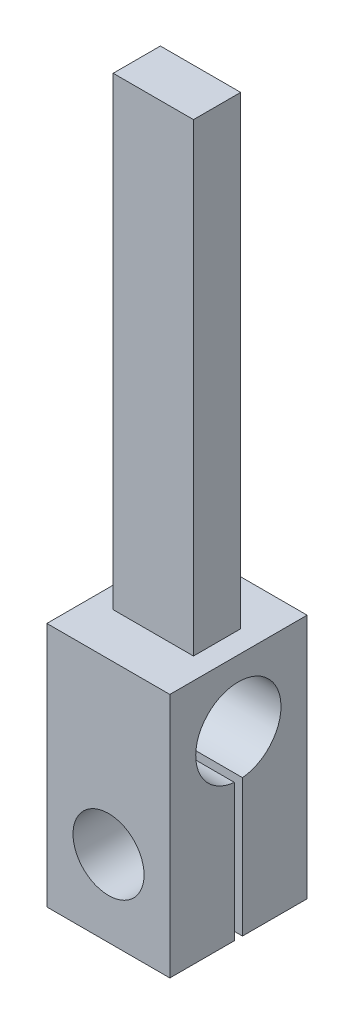
from build123d import *

# Parameters (mm, degrees)
BOSS_EXTRUDE2_DEPTH = 4.5
SKETCH3_R           = 1.3
CUT_EXTRUDE1_DEPTH  = 10.5
SKETCH6_W           = 2.938556516
SKETCH6_H           = 1.727001967
BOSS_EXTRUDE5_DEPTH = 17


with BuildPart() as part:
    # Sketch1 → Boss-Extrude2 (new body)
    with BuildSketch(Plane(origin=(0, 0, 0), x_dir=(0, 0, -1), z_dir=(1, 0, 0))):
        with BuildLine():
            Line((1.55613054, -9.91539795), (3.9164982, -9.916319844))
            Line((3.9164982, -9.916319844), (3.9164982, -4.895563354))
            ThreePointArc((3.9164982, -4.895563354), (4.059992057, -1.782444065), (4.214804462, -4.895021022))
            Line((4.214804462, -4.895021022), (4.214804462, -9.916436354))
            Line((4.214804462, -9.916436354), (6.579674081, -9.917360006))
            Line((6.579674081, -9.917360006), (6.579674081, -0.928463249))
            Line((6.579674081, -0.928463249), (1.55613054, -0.928463249))
            Line((1.55613054, -0.928463249), (1.55613054, -9.91539795))
        make_face()
    extrude(amount=BOSS_EXTRUDE2_DEPTH)

    # Sketch3 → Cut-Extrude1 (cut)
    with BuildSketch(Plane.XY.offset(-1.55613054)):
        with Locations((2.256029543, -7.121731935)):
            Circle(SKETCH3_R)
    extrude(amount=-CUT_EXTRUDE1_DEPTH, mode=Mode.SUBTRACT)

    # Sketch6 → Boss-Extrude5 (add)
    with BuildSketch(Plane(origin=(0, -0.928463249, 0), x_dir=(1, 0, 0), z_dir=(0, 1, 0))):
        with Locations((2.247156979, 4.067903294)):
            Rectangle(SKETCH6_W, SKETCH6_H)
    extrude(amount=BOSS_EXTRUDE5_DEPTH)


solid = part.part
